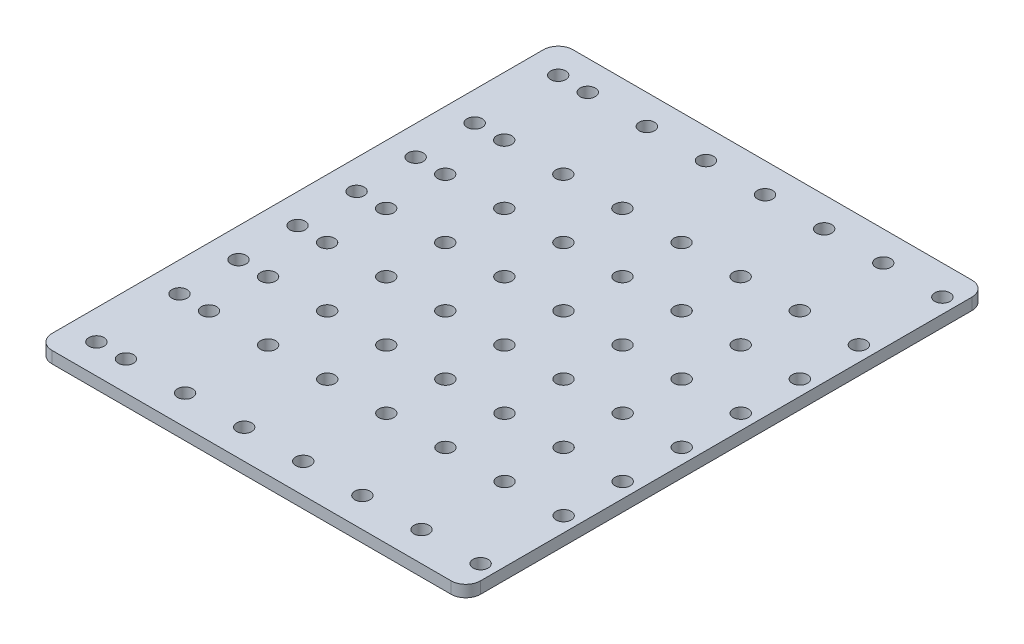
from build123d import *

# Parameters (mm, degrees)
SKETCH1_W           = 116
SKETCH1_H           = 141
SKETCH1_R           = 2.05
BOSS_EXTRUDE1_DEPTH = 3.175
FILLET1_R           = 4


with BuildPart() as part:
    # Sketch1 → Boss-Extrude1 (new body)
    with BuildSketch(Plane(origin=(0, 0, 0), x_dir=(1, 0, 0), z_dir=(0, 1, 0))):
        Rectangle(SKETCH1_W, SKETCH1_H)
        with Locations(Location((54, -62.5, 0), (0, 0, 270))):
            Circle(SKETCH1_R, mode=Mode.SUBTRACT)
        with Locations(Location((38, -62.5, 0), (0, 0, 270))):
            Circle(SKETCH1_R, mode=Mode.SUBTRACT)
        with Locations(Location((22, -62.5, 0), (0, 0, 270))):
            Circle(SKETCH1_R, mode=Mode.SUBTRACT)
        with Locations(Location((6, -62.5, 0), (0, 0, 270))):
            Circle(SKETCH1_R, mode=Mode.SUBTRACT)
        with Locations(Location((-10, -62.5, 0), (0, 0, 270))):
            Circle(SKETCH1_R, mode=Mode.SUBTRACT)
        with Locations(Location((-26, -62.5, 0), (0, 0, 270))):
            Circle(SKETCH1_R, mode=Mode.SUBTRACT)
        with Locations(Location((-42, -62.5, 0), (0, 0, 270))):
            Circle(SKETCH1_R, mode=Mode.SUBTRACT)
        with Locations(Location((-42, 62.5, 0), (0, 0, 90))):
            Circle(SKETCH1_R, mode=Mode.SUBTRACT)
        with Locations(Location((-26, 62.5, 0), (0, 0, 90))):
            Circle(SKETCH1_R, mode=Mode.SUBTRACT)
        with Locations(Location((-10, 62.5, 0), (0, 0, 90))):
            Circle(SKETCH1_R, mode=Mode.SUBTRACT)
        with Locations(Location((6, 62.5, 0), (0, 0, 90))):
            Circle(SKETCH1_R, mode=Mode.SUBTRACT)
        with Locations(Location((22, 62.5, 0), (0, 0, 90))):
            Circle(SKETCH1_R, mode=Mode.SUBTRACT)
        with Locations(Location((38, 62.5, 0), (0, 0, 90))):
            Circle(SKETCH1_R, mode=Mode.SUBTRACT)
        with Locations(Location((54, 62.5, 0), (0, 0, 90))):
            Circle(SKETCH1_R, mode=Mode.SUBTRACT)
        with Locations(Location((-26.018191243, -40, 0), (0, 0, 270))):
            Circle(SKETCH1_R, mode=Mode.SUBTRACT)
        with Locations(Location((-10.018191243, -40, 0), (0, 0, 270))):
            Circle(SKETCH1_R, mode=Mode.SUBTRACT)
        with Locations(Location((5.981808757, -40, 0), (0, 0, 270))):
            Circle(SKETCH1_R, mode=Mode.SUBTRACT)
        with Locations(Location((21.981808757, -40, 0), (0, 0, 270))):
            Circle(SKETCH1_R, mode=Mode.SUBTRACT)
        with Locations(Location((37.981808757, -40, 0), (0, 0, 270))):
            Circle(SKETCH1_R, mode=Mode.SUBTRACT)
        with Locations(Location((53.981808757, -40, 0), (0, 0, 270))):
            Circle(SKETCH1_R, mode=Mode.SUBTRACT)
        with Locations(Location((-26.036382485, -24, 0), (0, 0, 270))):
            Circle(SKETCH1_R, mode=Mode.SUBTRACT)
        with Locations(Location((-10.036382485, -24, 0), (0, 0, 270))):
            Circle(SKETCH1_R, mode=Mode.SUBTRACT)
        with Locations(Location((5.963617515, -24, 0), (0, 0, 270))):
            Circle(SKETCH1_R, mode=Mode.SUBTRACT)
        with Locations(Location((21.963617515, -24, 0), (0, 0, 270))):
            Circle(SKETCH1_R, mode=Mode.SUBTRACT)
        with Locations(Location((37.963617515, -24, 0), (0, 0, 270))):
            Circle(SKETCH1_R, mode=Mode.SUBTRACT)
        with Locations(Location((53.963617515, -24, 0), (0, 0, 270))):
            Circle(SKETCH1_R, mode=Mode.SUBTRACT)
        with Locations(Location((-26.054573728, -8, 0), (0, 0, 270))):
            Circle(SKETCH1_R, mode=Mode.SUBTRACT)
        with Locations(Location((-10.054573728, -8, 0), (0, 0, 270))):
            Circle(SKETCH1_R, mode=Mode.SUBTRACT)
        with Locations(Location((5.945426272, -8, 0), (0, 0, 270))):
            Circle(SKETCH1_R, mode=Mode.SUBTRACT)
        with Locations(Location((21.945426272, -8, 0), (0, 0, 270))):
            Circle(SKETCH1_R, mode=Mode.SUBTRACT)
        with Locations(Location((37.945426272, -8, 0), (0, 0, 270))):
            Circle(SKETCH1_R, mode=Mode.SUBTRACT)
        with Locations(Location((53.945426272, -8, 0), (0, 0, 270))):
            Circle(SKETCH1_R, mode=Mode.SUBTRACT)
        with Locations(Location((-26.072764971, 8, 0), (0, 0, 270))):
            Circle(SKETCH1_R, mode=Mode.SUBTRACT)
        with Locations(Location((-10.072764971, 8, 0), (0, 0, 270))):
            Circle(SKETCH1_R, mode=Mode.SUBTRACT)
        with Locations(Location((5.927235029, 8, 0), (0, 0, 270))):
            Circle(SKETCH1_R, mode=Mode.SUBTRACT)
        with Locations(Location((21.927235029, 8, 0), (0, 0, 270))):
            Circle(SKETCH1_R, mode=Mode.SUBTRACT)
        with Locations(Location((37.927235029, 8, 0), (0, 0, 270))):
            Circle(SKETCH1_R, mode=Mode.SUBTRACT)
        with Locations(Location((53.927235029, 8, 0), (0, 0, 270))):
            Circle(SKETCH1_R, mode=Mode.SUBTRACT)
        with Locations(Location((-26.090956213, 24, 0), (0, 0, 270))):
            Circle(SKETCH1_R, mode=Mode.SUBTRACT)
        with Locations(Location((-10.090956213, 24, 0), (0, 0, 270))):
            Circle(SKETCH1_R, mode=Mode.SUBTRACT)
        with Locations(Location((5.909043787, 24, 0), (0, 0, 270))):
            Circle(SKETCH1_R, mode=Mode.SUBTRACT)
        with Locations(Location((21.909043787, 24, 0), (0, 0, 270))):
            Circle(SKETCH1_R, mode=Mode.SUBTRACT)
        with Locations(Location((37.909043787, 24, 0), (0, 0, 270))):
            Circle(SKETCH1_R, mode=Mode.SUBTRACT)
        with Locations(Location((53.909043787, 24, 0), (0, 0, 270))):
            Circle(SKETCH1_R, mode=Mode.SUBTRACT)
        with Locations(Location((-26.109147456, 40, 0), (0, 0, 270))):
            Circle(SKETCH1_R, mode=Mode.SUBTRACT)
        with Locations(Location((-10.109147456, 40, 0), (0, 0, 270))):
            Circle(SKETCH1_R, mode=Mode.SUBTRACT)
        with Locations(Location((5.890852544, 40, 0), (0, 0, 270))):
            Circle(SKETCH1_R, mode=Mode.SUBTRACT)
        with Locations(Location((21.890852544, 40, 0), (0, 0, 270))):
            Circle(SKETCH1_R, mode=Mode.SUBTRACT)
        with Locations(Location((37.890852544, 40, 0), (0, 0, 270))):
            Circle(SKETCH1_R, mode=Mode.SUBTRACT)
        with Locations(Location((53.890852544, 40, 0), (0, 0, 270))):
            Circle(SKETCH1_R, mode=Mode.SUBTRACT)
        with Locations(Location((-42.018191243, -40, 0), (0, 0, 270))):
            Circle(SKETCH1_R, mode=Mode.SUBTRACT)
        with Locations(Location((-42.036382485, -24, 0), (0, 0, 270))):
            Circle(SKETCH1_R, mode=Mode.SUBTRACT)
        with Locations(Location((-42.054573728, -8, 0), (0, 0, 270))):
            Circle(SKETCH1_R, mode=Mode.SUBTRACT)
        with Locations(Location((-42.072764971, 8, 0), (0, 0, 270))):
            Circle(SKETCH1_R, mode=Mode.SUBTRACT)
        with Locations(Location((-42.090956213, 24, 0), (0, 0, 270))):
            Circle(SKETCH1_R, mode=Mode.SUBTRACT)
        with Locations(Location((-42.109147456, 40, 0), (0, 0, 270))):
            Circle(SKETCH1_R, mode=Mode.SUBTRACT)
        with Locations(Location((-50, -62.5, 0), (0, 0, 270))):
            Circle(SKETCH1_R, mode=Mode.SUBTRACT)
        with Locations(Location((-50.018191243, -40, 0), (0, 0, 270))):
            Circle(SKETCH1_R, mode=Mode.SUBTRACT)
        with Locations(Location((-50.036382485, -24, 0), (0, 0, 270))):
            Circle(SKETCH1_R, mode=Mode.SUBTRACT)
        with Locations(Location((-50.054573728, -8, 0), (0, 0, 270))):
            Circle(SKETCH1_R, mode=Mode.SUBTRACT)
        with Locations(Location((-50.072764971, 8, 0), (0, 0, 270))):
            Circle(SKETCH1_R, mode=Mode.SUBTRACT)
        with Locations(Location((-50.090956213, 24, 0), (0, 0, 270))):
            Circle(SKETCH1_R, mode=Mode.SUBTRACT)
        with Locations(Location((-50, 62.5, 0), (0, 0, 90))):
            Circle(SKETCH1_R, mode=Mode.SUBTRACT)
        with Locations(Location((-50.109147456, 40, 0), (0, 0, 270))):
            Circle(SKETCH1_R, mode=Mode.SUBTRACT)
    extrude(amount=BOSS_EXTRUDE1_DEPTH)

    # Fillet1
    fillet1_edges = [part.edges().sort_by_distance(p)[0] for p in [
        (58, 1.5875, 70.5),
        (-58, 1.5875, 70.5),
        (-58, 1.5875, -70.5),
        (58, 1.5875, -70.5),
    ]]
    fillet(fillet1_edges, radius=FILLET1_R)


solid = part.part
